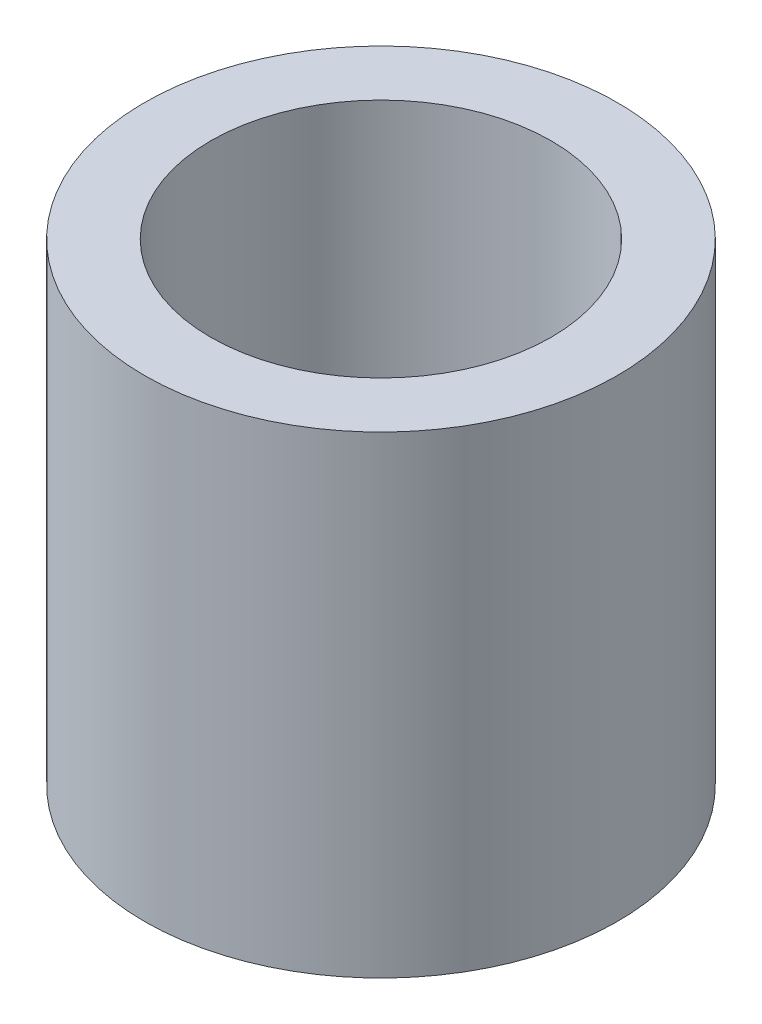
from build123d import *

# Parameters (mm, degrees)
SKETCH1_R           = 12.5
SKETCH1_R_2         = 9
BOSS_EXTRUDE1_DEPTH = 25


with BuildPart() as part:
    # Sketch1 → Boss-Extrude1 (new body)
    with BuildSketch(Plane(origin=(0, 0, 0), x_dir=(1, 0, 0), z_dir=(0, 1, 0))):
        with Locations(Location((0, 0, 0), (0, 0, 270))):
            Circle(SKETCH1_R)
        with Locations(Location((0, 0, 0), (0, 0, 270))):
            Circle(SKETCH1_R_2, mode=Mode.SUBTRACT)
    extrude(amount=BOSS_EXTRUDE1_DEPTH)


solid = part.part
